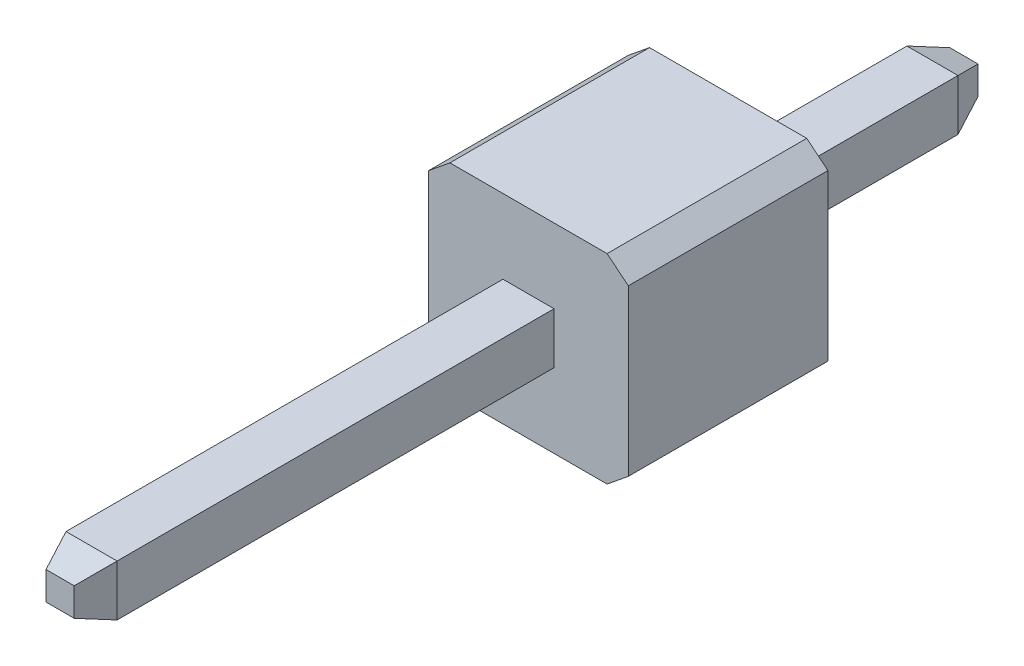
from build123d import *
from OCP.BRepFilletAPI import BRepFilletAPI_MakeChamfer

# Parameters (mm, degrees)
SKETCH1_W           = 0.65
SKETCH1_H           = 0.65
BOSS_EXTRUDE1_DEPTH = 11.5
CHAMFER2_SIZE       = 0.4
CHAMFER2_SIZE2      = 0.145588094
CHAMFER3_SIZE       = 0.4
CHAMFER3_SIZE2      = 0.145588094
PLASTIC_DEPTH       = 2.54


with BuildPart() as part:
    # Sketch1 → Boss-Extrude1 (new body)
    with BuildSketch(Plane.XY):
        Rectangle(SKETCH1_W, SKETCH1_H)
    extrude(amount=BOSS_EXTRUDE1_DEPTH)

    # Chamfer2: one chamfer whose edges measure the first distance from different faces: ONE call of the kernel's chamfer builder (chamfer() names one face for all edges)
    chamfer2_edges_1 = [part.edges().sort_by_distance(p)[0] for p in [
        (0.325, 0, 11.5),
    ]]
    chamfer2_side_1 = [part.faces().sort_by_distance(p)[0] for p in [
        (0.325, 0, 5.75),
    ]]
    chamfer2_edges_2 = [part.edges().sort_by_distance(p)[0] for p in [
        (0, 0.325, 11.5),
    ]]
    chamfer2_side_2 = [part.faces().sort_by_distance(p)[0] for p in [
        (0, 0.325, 5.75),
    ]]
    chamfer2_edges_3 = [part.edges().sort_by_distance(p)[0] for p in [
        (-0.325, 0, 11.5),
    ]]
    chamfer2_side_3 = [part.faces().sort_by_distance(p)[0] for p in [
        (-0.325, 0, 5.75),
    ]]
    chamfer2_edges_4 = [part.edges().sort_by_distance(p)[0] for p in [
        (0, -0.325, 11.5),
    ]]
    chamfer2_side_4 = [part.faces().sort_by_distance(p)[0] for p in [
        (0, -0.325, 5.75),
    ]]
    chamfer2 = BRepFilletAPI_MakeChamfer(part.part.solid().wrapped)
    for e in chamfer2_edges_1:
        chamfer2.Add(CHAMFER2_SIZE, CHAMFER2_SIZE2, e.wrapped, chamfer2_side_1[0].wrapped)  # the first distance lies on this face
    for e in chamfer2_edges_2:
        chamfer2.Add(CHAMFER2_SIZE, CHAMFER2_SIZE2, e.wrapped, chamfer2_side_2[0].wrapped)  # the first distance lies on this face
    for e in chamfer2_edges_3:
        chamfer2.Add(CHAMFER2_SIZE, CHAMFER2_SIZE2, e.wrapped, chamfer2_side_3[0].wrapped)  # the first distance lies on this face
    for e in chamfer2_edges_4:
        chamfer2.Add(CHAMFER2_SIZE, CHAMFER2_SIZE2, e.wrapped, chamfer2_side_4[0].wrapped)  # the first distance lies on this face
    add(Compound.cast(chamfer2.Shape()), mode=Mode.REPLACE)

    # Chamfer3: one chamfer whose edges measure the first distance from different faces: ONE call of the kernel's chamfer builder (chamfer() names one face for all edges)
    chamfer3_edges_1 = [part.edges().sort_by_distance(p)[0] for p in [
        (0, 0.325, 0),
    ]]
    chamfer3_side_1 = [part.faces().sort_by_distance(p)[0] for p in [
        (0, 0.325, 5.55),
    ]]
    chamfer3_edges_2 = [part.edges().sort_by_distance(p)[0] for p in [
        (0.325, 0, 0),
    ]]
    chamfer3_side_2 = [part.faces().sort_by_distance(p)[0] for p in [
        (0.325, 0, 5.55),
    ]]
    chamfer3_edges_3 = [part.edges().sort_by_distance(p)[0] for p in [
        (0, -0.325, 0),
    ]]
    chamfer3_side_3 = [part.faces().sort_by_distance(p)[0] for p in [
        (0, -0.325, 5.55),
    ]]
    chamfer3_edges_4 = [part.edges().sort_by_distance(p)[0] for p in [
        (-0.325, 0, 0),
    ]]
    chamfer3_side_4 = [part.faces().sort_by_distance(p)[0] for p in [
        (-0.325, 0, 5.55),
    ]]
    chamfer3 = BRepFilletAPI_MakeChamfer(part.part.solid().wrapped)
    for e in chamfer3_edges_1:
        chamfer3.Add(CHAMFER3_SIZE, CHAMFER3_SIZE2, e.wrapped, chamfer3_side_1[0].wrapped)  # the first distance lies on this face
    for e in chamfer3_edges_2:
        chamfer3.Add(CHAMFER3_SIZE, CHAMFER3_SIZE2, e.wrapped, chamfer3_side_2[0].wrapped)  # the first distance lies on this face
    for e in chamfer3_edges_3:
        chamfer3.Add(CHAMFER3_SIZE, CHAMFER3_SIZE2, e.wrapped, chamfer3_side_3[0].wrapped)  # the first distance lies on this face
    for e in chamfer3_edges_4:
        chamfer3.Add(CHAMFER3_SIZE, CHAMFER3_SIZE2, e.wrapped, chamfer3_side_4[0].wrapped)  # the first distance lies on this face
    add(Compound.cast(chamfer3.Shape()), mode=Mode.REPLACE)

    # Sketch2 → Plastic (add)
    with BuildSketch(Plane(origin=(0, 0, 3), x_dir=(-1, 0, 0), z_dir=(0, 0, -1))):
        Polygon((-1, 1.27), (1, 1.27), (1.27, 1.05), (1.27, -1.05), (1, -1.27), (-1, -1.27), (-1.27, -1.05), (-1.27, 1.05), align=None)
    extrude(amount=-PLASTIC_DEPTH)


solid = part.part
